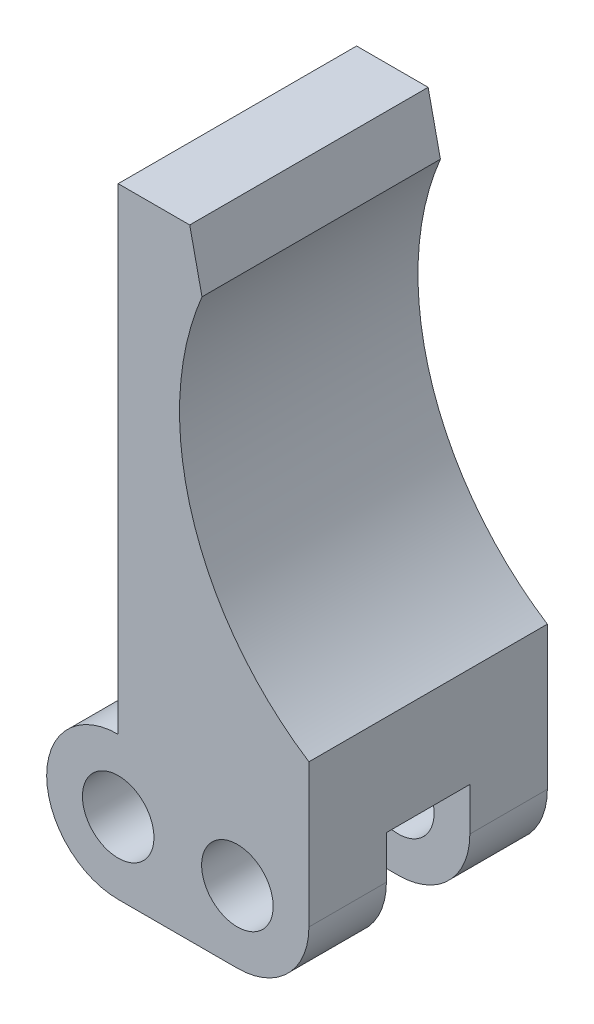
from build123d import *

# Parameters (mm, degrees)
SKETCH1_R           = 1.5
BOSS_EXTRUDE1_DEPTH = 5
SKETCH2_R           = 1.5
CUT_EXTRUDE1_DEPTH  = 1.75


with BuildPart() as part:
    # Sketch1 → Boss-Extrude1 (new, symmetric)
    with BuildSketch(Plane.XY):
        with BuildLine():
            Line((0, -3), (5, -3))
            ThreePointArc((5, -3), (7.121320344, -2.121320344), (8, 0))
            Line((8, 0), (8, 6))
            ThreePointArc((8, 6), (3.095785062, 12.50802611), (3.515332481, 20.646189784))
            Line((3.515332481, 20.646189784), (3, 23))
            Line((3, 23), (0, 23))
            Line((0, 23), (0, 3))
            ThreePointArc((0, 3), (-3, 0), (0, -3))
        make_face()
        Circle(SKETCH1_R, mode=Mode.SUBTRACT)
        with Locations((5, 0)):
            Circle(SKETCH1_R, mode=Mode.SUBTRACT)
    extrude(amount=BOSS_EXTRUDE1_DEPTH, both=True)

    # Sketch2 → Cut-Extrude1 (cut, symmetric)
    with BuildSketch(Plane.XY):
        with BuildLine():
            Line((0, 3.5), (5, 3.5))
            ThreePointArc((5, 3.5), (8.5, 0), (5, -3.5))
            Line((5, -3.5), (0, -3.5))
            ThreePointArc((0, -3.5), (-3.5, 0), (0, 3.5))
        make_face()
        Circle(SKETCH2_R, mode=Mode.SUBTRACT)
        with Locations((5, 0)):
            Circle(SKETCH2_R, mode=Mode.SUBTRACT)
    extrude(amount=CUT_EXTRUDE1_DEPTH, both=True, mode=Mode.SUBTRACT)


solid = part.part
